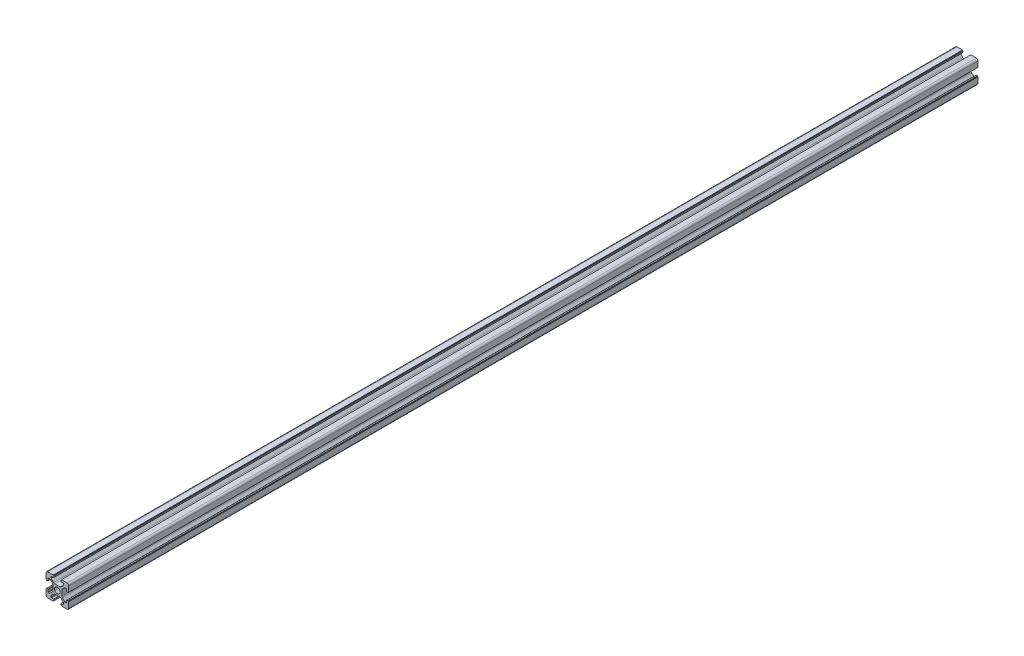
from build123d import *

# Parameters (mm, degrees)
SKETCH_1_R      = 2.5
EXTRUDE_1_DEPTH = 800


with BuildPart() as part:
    # 草图1 → 凸台-拉伸1 (new body)
    with BuildSketch(Plane.XY):
        with BuildLine():
            Line((4.215995631, 3.244230202), (6.436655803, 5.464890373))
            Line((6.436655803, 5.464890373), (7.776655803, 5.464890373))
            ThreePointArc((7.776655803, 5.464890373), (7.988787838, 5.377022408), (8.076655803, 5.164890373))
            Line((8.076655803, 5.164890373), (8.076655803, 3.364890373))
            ThreePointArc((8.076655803, 3.364890373), (8.164523769, 3.152758339), (8.376655803, 3.064890373))
            Line((8.376655803, 3.064890373), (9.376655803, 3.064890373))
            Line((9.376655803, 3.064890373), (9.376655803, 3.364890373))
            ThreePointArc((9.376655803, 3.364890373), (9.435234447, 3.50631173), (9.576655803, 3.564890373))
            Line((9.576655803, 3.564890373), (9.876655803, 3.564890373))
            Line((9.876655803, 3.564890373), (9.876655803, 8.464890373))
            ThreePointArc((9.876655803, 8.464890373), (9.437315975, 9.525550545), (8.376655803, 9.964890373))
            Line((8.376655803, 9.964890373), (3.476655803, 9.964890373))
            Line((3.476655803, 9.964890373), (3.476655803, 9.664890373))
            ThreePointArc((3.476655803, 9.664890373), (3.418077159, 9.523469017), (3.276655803, 9.464890373))
            Line((3.276655803, 9.464890373), (2.976655803, 9.464890373))
            Line((2.976655803, 9.464890373), (2.976655803, 8.464890373))
            ThreePointArc((2.976655803, 8.464890373), (3.064523769, 8.252758339), (3.276655803, 8.164890373))
            Line((3.276655803, 8.164890373), (5.076655803, 8.164890373))
            ThreePointArc((5.076655803, 8.164890373), (5.288787838, 8.077022408), (5.376655803, 7.864890373))
            Line((5.376655803, 7.864890373), (5.376655803, 6.524890373))
            Line((5.376655803, 6.524890373), (3.155995631, 4.304230202))
            ThreePointArc((3.155995631, 4.304230202), (2.669360608, 3.979071075), (2.09533546, 3.864890373))
            Line((2.09533546, 3.864890373), (-2.342023853, 3.864890373))
            ThreePointArc((-2.342023853, 3.864890373), (-2.916049002, 3.979071075), (-3.402684025, 4.304230202))
            Line((-3.402684025, 4.304230202), (-5.623344197, 6.524890373))
            Line((-5.623344197, 6.524890373), (-5.623344197, 7.864890373))
            ThreePointArc((-5.623344197, 7.864890373), (-5.535476231, 8.077022408), (-5.323344197, 8.164890373))
            Line((-5.323344197, 8.164890373), (-3.523344197, 8.164890373))
            ThreePointArc((-3.523344197, 8.164890373), (-3.311212162, 8.252758339), (-3.223344197, 8.464890373))
            Line((-3.223344197, 8.464890373), (-3.223344197, 9.464890373))
            Line((-3.223344197, 9.464890373), (-3.523344197, 9.464890373))
            ThreePointArc((-3.523344197, 9.464890373), (-3.664765553, 9.523469017), (-3.723344197, 9.664890373))
            Line((-3.723344197, 9.664890373), (-3.723344197, 9.964890373))
            Line((-3.723344197, 9.964890373), (-8.623344197, 9.964890373))
            ThreePointArc((-8.623344197, 9.964890373), (-9.684004369, 9.525550545), (-10.123344197, 8.464890373))
            Line((-10.123344197, 8.464890373), (-10.123344197, 3.564890373))
            Line((-10.123344197, 3.564890373), (-9.823344197, 3.564890373))
            ThreePointArc((-9.823344197, 3.564890373), (-9.681922841, 3.50631173), (-9.623344197, 3.364890373))
            Line((-9.623344197, 3.364890373), (-9.623344197, 3.064890373))
            Line((-9.623344197, 3.064890373), (-8.623344197, 3.064890373))
            ThreePointArc((-8.623344197, 3.064890373), (-8.411212162, 3.152758339), (-8.323344197, 3.364890373))
            Line((-8.323344197, 3.364890373), (-8.323344197, 5.164890373))
            ThreePointArc((-8.323344197, 5.164890373), (-8.235476231, 5.377022408), (-8.023344197, 5.464890373))
            Line((-8.023344197, 5.464890373), (-6.683344197, 5.464890373))
            Line((-6.683344197, 5.464890373), (-4.462684025, 3.244230202))
            ThreePointArc((-4.462684025, 3.244230202), (-4.137524898, 2.757595178), (-4.023344197, 2.18357003))
            Line((-4.023344197, 2.18357003), (-4.023344197, -2.253789283))
            ThreePointArc((-4.023344197, -2.253789283), (-4.137524898, -2.827814432), (-4.462684025, -3.314449455))
            Line((-4.462684025, -3.314449455), (-6.683344197, -5.535109627))
            Line((-6.683344197, -5.535109627), (-8.023344197, -5.535109627))
            ThreePointArc((-8.023344197, -5.535109627), (-8.235476231, -5.447241661), (-8.323344197, -5.235109627))
            Line((-8.323344197, -5.235109627), (-8.323344197, -3.435109627))
            ThreePointArc((-8.323344197, -3.435109627), (-8.411212162, -3.222977592), (-8.623344197, -3.135109627))
            Line((-8.623344197, -3.135109627), (-9.623344197, -3.135109627))
            Line((-9.623344197, -3.135109627), (-9.623344197, -3.435109627))
            ThreePointArc((-9.623344197, -3.435109627), (-9.681922841, -3.576530983), (-9.823344197, -3.635109627))
            Line((-9.823344197, -3.635109627), (-10.123344197, -3.635109627))
            Line((-10.123344197, -3.635109627), (-10.123344197, -8.535109627))
            ThreePointArc((-10.123344197, -8.535109627), (-9.684004369, -9.595769798), (-8.623344197, -10.035109627))
            Line((-8.623344197, -10.035109627), (-3.723344197, -10.035109627))
            Line((-3.723344197, -10.035109627), (-3.723344197, -9.735109627))
            ThreePointArc((-3.723344197, -9.735109627), (-3.664765553, -9.59368827), (-3.523344197, -9.535109627))
            Line((-3.523344197, -9.535109627), (-3.223344197, -9.535109627))
            Line((-3.223344197, -9.535109627), (-3.223344197, -8.535109627))
            ThreePointArc((-3.223344197, -8.535109627), (-3.311212162, -8.322977592), (-3.523344197, -8.235109627))
            Line((-3.523344197, -8.235109627), (-5.323344197, -8.235109627))
            ThreePointArc((-5.323344197, -8.235109627), (-5.535476231, -8.147241661), (-5.623344197, -7.935109627))
            Line((-5.623344197, -7.935109627), (-5.623344197, -6.595109627))
            Line((-5.623344197, -6.595109627), (-3.402684025, -4.374449455))
            ThreePointArc((-3.402684025, -4.374449455), (-2.916049002, -4.049290328), (-2.342023853, -3.935109627))
            Line((-2.342023853, -3.935109627), (2.09533546, -3.935109627))
            ThreePointArc((2.09533546, -3.935109627), (2.669360608, -4.049290328), (3.155995631, -4.374449455))
            Line((3.155995631, -4.374449455), (5.376655803, -6.595109627))
            Line((5.376655803, -6.595109627), (5.376655803, -7.935109627))
            ThreePointArc((5.376655803, -7.935109627), (5.288787838, -8.147241661), (5.076655803, -8.235109627))
            Line((5.076655803, -8.235109627), (3.276655803, -8.235109627))
            ThreePointArc((3.276655803, -8.235109627), (3.064523769, -8.322977592), (2.976655803, -8.535109627))
            Line((2.976655803, -8.535109627), (2.976655803, -9.535109627))
            Line((2.976655803, -9.535109627), (3.276655803, -9.535109627))
            ThreePointArc((3.276655803, -9.535109627), (3.418077159, -9.59368827), (3.476655803, -9.735109627))
            Line((3.476655803, -9.735109627), (3.476655803, -10.035109627))
            Line((3.476655803, -10.035109627), (8.376655803, -10.035109627))
            ThreePointArc((8.376655803, -10.035109627), (9.437315975, -9.595769798), (9.876655803, -8.535109627))
            Line((9.876655803, -8.535109627), (9.876655803, -3.635109627))
            Line((9.876655803, -3.635109627), (9.576655803, -3.635109627))
            ThreePointArc((9.576655803, -3.635109627), (9.435234447, -3.576530983), (9.376655803, -3.435109627))
            Line((9.376655803, -3.435109627), (9.376655803, -3.135109627))
            Line((9.376655803, -3.135109627), (8.376655803, -3.135109627))
            ThreePointArc((8.376655803, -3.135109627), (8.164523769, -3.222977592), (8.076655803, -3.435109627))
            Line((8.076655803, -3.435109627), (8.076655803, -5.235109627))
            ThreePointArc((8.076655803, -5.235109627), (7.988787838, -5.447241661), (7.776655803, -5.535109627))
            Line((7.776655803, -5.535109627), (6.436655803, -5.535109627))
            Line((6.436655803, -5.535109627), (4.215995631, -3.314449455))
            ThreePointArc((4.215995631, -3.314449455), (3.890836504, -2.827814432), (3.776655803, -2.253789283))
            Line((3.776655803, -2.253789283), (3.776655803, 2.18357003))
            ThreePointArc((3.776655803, 2.18357003), (3.890836504, 2.757595178), (4.215995631, 3.244230202))
        make_face()
        with Locations((-0.123344197, -0.035109627)):
            Circle(SKETCH_1_R, mode=Mode.SUBTRACT)
    extrude(amount=EXTRUDE_1_DEPTH)


solid = part.part
